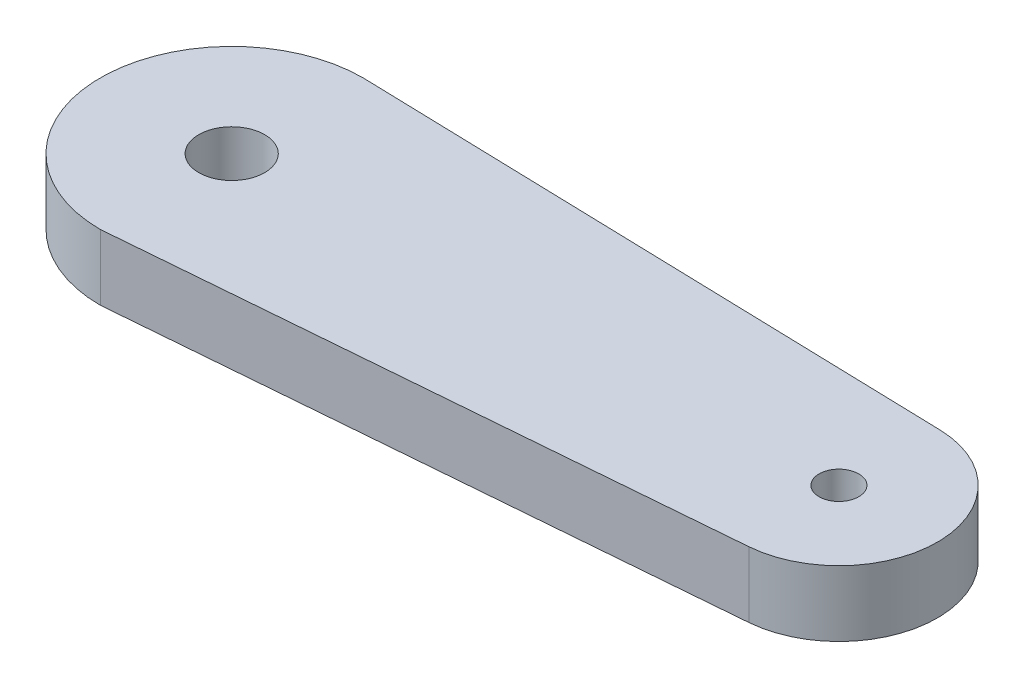
from build123d import *

# Parameters (mm, degrees)
BOSS_EXTRUDE1_DEPTH = 5
CUT_EXTRUDE1_REACH  = 55.66
SKETCH2_R           = 2.51
SKETCH2_R_2         = 1.51


with BuildPart() as part:
    # Sketch1 → Boss-Extrude1 (new body)
    with BuildSketch(Plane(origin=(0, 0, 0), x_dir=(1, 0, 0), z_dir=(0, 1, 0))):
        with BuildLine():
            ThreePointArc((0, 10), (-10, 0), (0, -10))
            Line((0, -10), (45.601011206, -6.227938292))
            ThreePointArc((45.601011206, -6.227938292), (52.479923025, 1.451771759), (45.191159304, 8.743636932))
            Line((45.191159304, 8.743636932), (0, 10))
        make_face()
    extrude(amount=BOSS_EXTRUDE1_DEPTH)

    # Sketch2 → Cut-Extrude1 (cut, up to next)
    with BuildSketch(Plane(origin=(0, 5, 0), x_dir=(1, 0, 0), z_dir=(0, 1, 0)), mode=Mode.PRIVATE) as cut_extrude1_sk1:
        with Locations(Location((0, 0, 0), (0, 0, 270))):
            Circle(SKETCH2_R)
    cut_extrude1_tool1 = extrude(cut_extrude1_sk1.sketch, amount=-CUT_EXTRUDE1_REACH, mode=Mode.PRIVATE) & part.part
    # Sketch2 → Cut-Extrude1 (cut, up to next)
    with BuildSketch(Plane(origin=(0, 5, 0), x_dir=(1, 0, 0), z_dir=(0, 1, 0)), mode=Mode.PRIVATE) as cut_extrude1_sk2:
        with Locations(Location((44.98273173, 1.246533628, 0), (0, 0, 270))):
            Circle(SKETCH2_R_2)
    cut_extrude1_tool2 = extrude(cut_extrude1_sk2.sketch, amount=-CUT_EXTRUDE1_REACH, mode=Mode.PRIVATE) & part.part
    add(cut_extrude1_tool1.solids().sort_by_distance((0, 5, 0))[0], mode=Mode.SUBTRACT)
    add(cut_extrude1_tool2.solids().sort_by_distance((44.982732, 5, -1.246534))[0], mode=Mode.SUBTRACT)


solid = part.part
